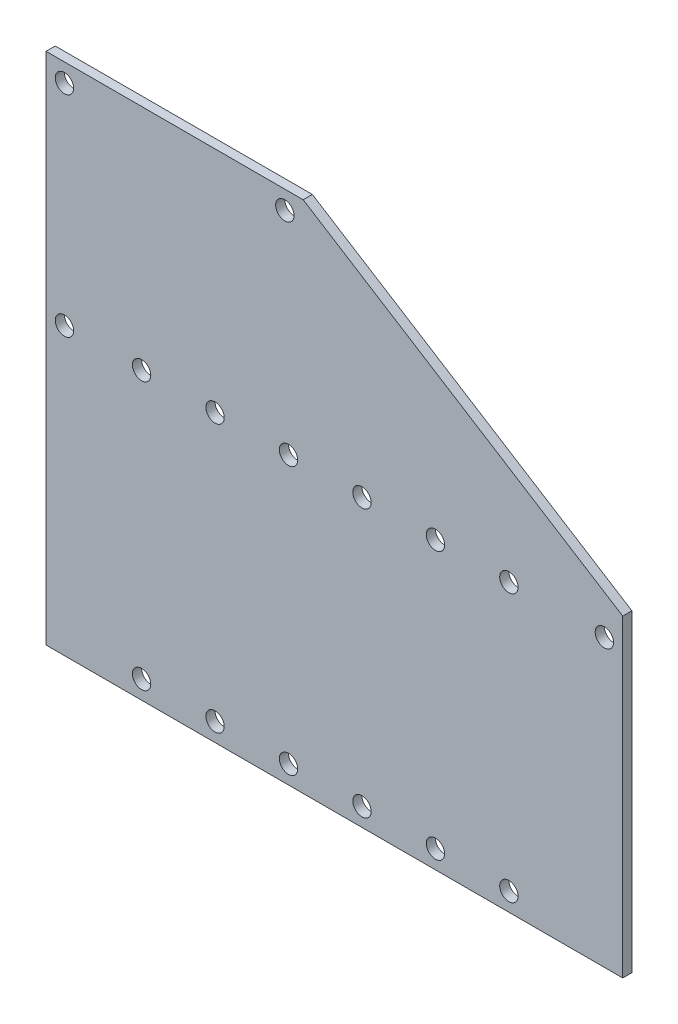
from build123d import *

# Parameters (mm, degrees)
SKETCH1_W           = 199.39
SKETCH1_H           = 177.8
BOSS_EXTRUDE1_DEPTH = 3.175
CUT_EXTRUDE4_DEPTH  = 134.612812447
SKETCH7_R           = 3.175
CUT_EXTRUDE5_DEPTH  = 134.612812447


with BuildPart() as part:
    # Sketch1 → Boss-Extrude1 (new body)
    with BuildSketch(Plane.XY):
        Rectangle(SKETCH1_W, SKETCH1_H)
    extrude(amount=BOSS_EXTRUDE1_DEPTH)

    # Sketch6 → Cut-Extrude4 (cut, through all)
    with BuildSketch(Plane.XY.offset(3.175)):
        Polygon((99.695, 88.9), (99.695, 19.474999912), (-10.795, 88.9), align=None)
    extrude(amount=-CUT_EXTRUDE4_DEPTH, mode=Mode.SUBTRACT)

    # Sketch7 → Cut-Extrude5 (cut, through all)
    with BuildSketch(Plane.XY.offset(3.175)):
        with Locations((-93.345, 82.55)):
            Circle(SKETCH7_R)
        with Locations((-93.345, 9.949999912)):
            Circle(SKETCH7_R)
        with Locations((93.345, 9.949999912)):
            Circle(SKETCH7_R)
        with Locations((-66.675, 9.949999912)):
            Circle(SKETCH7_R)
        with Locations((-41.275, 9.949999912)):
            Circle(SKETCH7_R)
        with Locations((-15.875, 9.949999912)):
            Circle(SKETCH7_R)
        with Locations((9.525, 9.949999912)):
            Circle(SKETCH7_R)
        with Locations((34.925, 9.949999912)):
            Circle(SKETCH7_R)
        with Locations((60.325, 9.949999912)):
            Circle(SKETCH7_R)
        with Locations((-17.145, 82.55)):
            Circle(SKETCH7_R)
        with Locations((-66.675, -82.55)):
            Circle(SKETCH7_R)
        with Locations((-41.275, -82.55)):
            Circle(SKETCH7_R)
        with Locations((-15.875, -82.55)):
            Circle(SKETCH7_R)
        with Locations((9.525, -82.55)):
            Circle(SKETCH7_R)
        with Locations((34.925, -82.55)):
            Circle(SKETCH7_R)
        with Locations((60.325, -82.55)):
            Circle(SKETCH7_R)
    extrude(amount=-CUT_EXTRUDE5_DEPTH, mode=Mode.SUBTRACT)


solid = part.part
